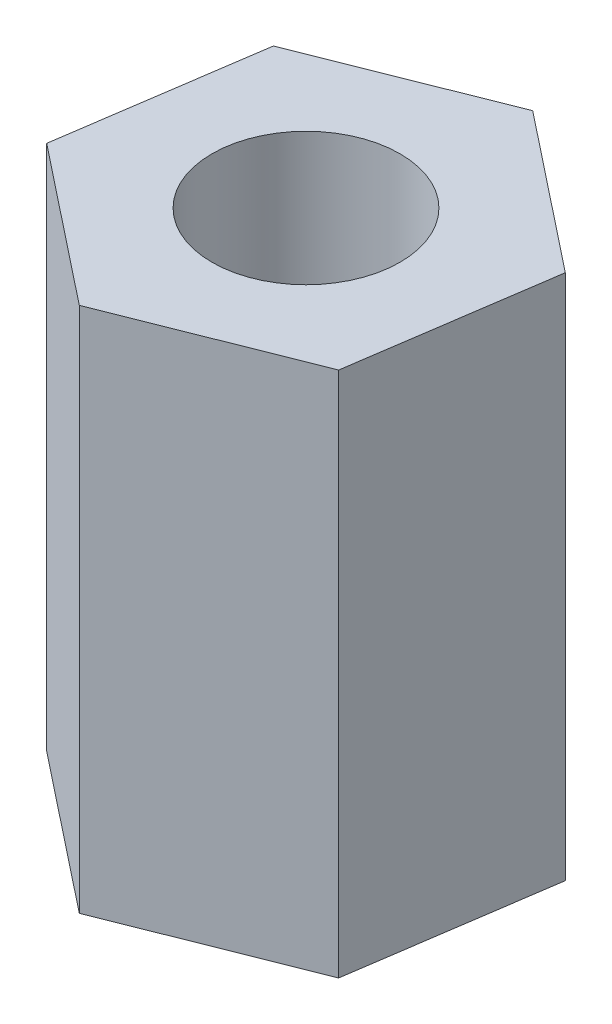
from build123d import *

# Parameters (mm, degrees)
SALIENTE_EXTRUIR1_DEPTH = 7
CROQUIS_CARA_R          = 1.25
CORTAR_EXTRUIR1_DEPTH   = 7


with BuildPart() as part:
    # Croquis base → Saliente-Extruir1 (new body)
    with BuildSketch(Plane(origin=(0, 0, 0), x_dir=(1, 0, 0), z_dir=(0, 1, 0))):
        Polygon((2.082277712, -1.648469855), (2.468755628, 0.979070469), (0.386477916, 2.627540324), (-2.082277712, 1.648469855), (-2.468755628, -0.979070469), (-0.386477916, -2.627540324), align=None)
    extrude(amount=SALIENTE_EXTRUIR1_DEPTH)

    # Croquis cara → Cortar-Extruir1 (cut)
    with BuildSketch(Plane(origin=(0, 7, 0), x_dir=(1, 0, 0), z_dir=(0, 1, 0))):
        with Locations(Location((0, 0, 0), (0, 0, 270))):
            Circle(CROQUIS_CARA_R)
    extrude(amount=-CORTAR_EXTRUIR1_DEPTH, mode=Mode.SUBTRACT)


solid = part.part
